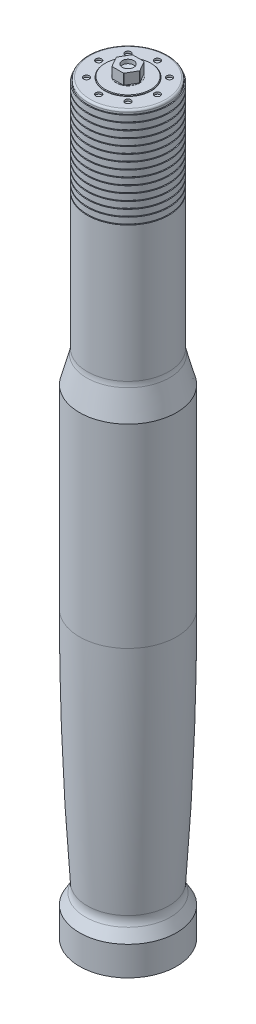
from build123d import *

# Parameters (mm, degrees)
SKETCH7_R          = 1
CUT_EXTRUDE1_DEPTH = 5.4
CIRPATTERN2_COUNT  = 8


with BuildPart() as part:
    # Sketch1 → Revolve1 (revolve)
    with BuildSketch(Plane.XY, mode=Mode.PRIVATE) as revolve1_sk:
        with BuildLine():
            Line((-19, 190.92476708), (-19, -190.92476708))
            Line((-19, -190.92476708), (-25, -190.92476708))
            Line((-25, -190.92476708), (-25, -175.92476708))
            Line((-25, -175.92476708), (-21.881748411, -170.523796897))
            ThreePointArc((-21.881748411, -170.523796897), (-21.053040899, -168.29863928), (-21, -165.92476708))
            ThreePointArc((-21, -165.92476708), (-23.999731053, -104.996900832), (-25, -44.00343615))
            Line((-25, -44.00343615), (-25, 55.99656385))
            Line((-25, 55.99656385), (-21.340741737, 69.653101605))
            ThreePointArc((-21.340741737, 69.653101605), (-21.085551386, 70.936030134), (-21, 72.241292056))
            Line((-21, 72.241292056), (-21, 141.92476708))
            Line((-21, 141.92476708), (-20.5, 141.92476708))
            Line((-20.5, 141.92476708), (-20.5, 142.42476708))
            Line((-20.5, 142.42476708), (-21, 142.42476708))
            Line((-21, 142.42476708), (-21, 145.42476708))
            Line((-21, 145.42476708), (-20.5, 145.42476708))
            Line((-20.5, 145.42476708), (-20.5, 145.92476708))
            Line((-20.5, 145.92476708), (-21, 145.92476708))
            Line((-21, 145.92476708), (-21, 148.92476708))
            Line((-21, 148.92476708), (-20.5, 148.92476708))
            Line((-20.5, 148.92476708), (-20.5, 149.42476708))
            Line((-20.5, 149.42476708), (-21, 149.42476708))
            Line((-21, 149.42476708), (-21, 152.42476708))
            Line((-21, 152.42476708), (-20.5, 152.42476708))
            Line((-20.5, 152.42476708), (-20.5, 152.92476708))
            Line((-20.5, 152.92476708), (-21, 152.92476708))
            Line((-21, 152.92476708), (-21, 155.92476708))
            Line((-21, 155.92476708), (-20.5, 155.92476708))
            Line((-20.5, 155.92476708), (-20.5, 156.42476708))
            Line((-20.5, 156.42476708), (-21, 156.42476708))
            Line((-21, 156.42476708), (-21, 159.42476708))
            Line((-21, 159.42476708), (-20.5, 159.42476708))
            Line((-20.5, 159.42476708), (-20.5, 159.92476708))
            Line((-20.5, 159.92476708), (-21, 159.92476708))
            Line((-21, 159.92476708), (-21, 162.92476708))
            Line((-21, 162.92476708), (-20.5, 162.92476708))
            Line((-20.5, 162.92476708), (-20.5, 163.42476708))
            Line((-20.5, 163.42476708), (-21, 163.42476708))
            Line((-21, 163.42476708), (-21, 166.42476708))
            Line((-21, 166.42476708), (-20.5, 166.42476708))
            Line((-20.5, 166.42476708), (-20.5, 166.92476708))
            Line((-20.5, 166.92476708), (-21, 166.92476708))
            Line((-21, 166.92476708), (-21, 169.92476708))
            Line((-21, 169.92476708), (-20.5, 169.92476708))
            Line((-20.5, 169.92476708), (-20.5, 170.42476708))
            Line((-20.5, 170.42476708), (-21, 170.42476708))
            Line((-21, 170.42476708), (-21, 173.42476708))
            Line((-21, 173.42476708), (-20.5, 173.42476708))
            Line((-20.5, 173.42476708), (-20.5, 173.92476708))
            Line((-20.5, 173.92476708), (-21, 173.92476708))
            Line((-21, 173.92476708), (-21, 176.92476708))
            Line((-21, 176.92476708), (-20.5, 176.92476708))
            Line((-20.5, 176.92476708), (-20.5, 177.42476708))
            Line((-20.5, 177.42476708), (-21, 177.42476708))
            Line((-21, 177.42476708), (-21, 180.42476708))
            Line((-21, 180.42476708), (-20.5, 180.42476708))
            Line((-20.5, 180.42476708), (-20.5, 180.92476708))
            Line((-20.5, 180.92476708), (-21, 180.92476708))
            Line((-21, 180.92476708), (-21, 183.92476708))
            Line((-21, 183.92476708), (-20.5, 183.92476708))
            Line((-20.5, 183.92476708), (-20.5, 184.42476708))
            Line((-20.5, 184.42476708), (-21, 184.42476708))
            Line((-21, 184.42476708), (-21, 187.42476708))
            Line((-21, 187.42476708), (-20.5, 187.42476708))
            Line((-20.5, 187.42476708), (-20.5, 187.92476708))
            Line((-20.5, 187.92476708), (-21, 187.92476708))
            Line((-21, 187.92476708), (-21, 190.92476708))
            Line((-21, 190.92476708), (-19, 190.92476708))
        make_face()
    revolve(revolve1_sk.sketch.rotate(Axis((0, 0, 0), (0, 1, 0)), 270), axis=Axis((0, 0, 0), (0, 1, 0)))


with BuildPart() as body_2:
    # Sketch4 → Revolve2 (revolve)
    with BuildSketch(Plane(origin=(0, 0, 0), x_dir=(0, 0, -1), z_dir=(1, 0, 0))):
        with BuildLine():
            Line((-20.5, 190.92476708), (0, 190.92476708))
            Line((0, 190.92476708), (0, 192.92476708))
            Line((0, 192.92476708), (-19.5, 192.92476708))
            ThreePointArc((-19.5, 192.92476708), (-20.207106781, 192.631873861), (-20.5, 191.92476708))
            Line((-20.5, 191.92476708), (-20.5, 190.92476708))
        make_face()
    revolve(axis=Axis((0, 192.92476708, 0), (0, -1, 0)))

    # Sketch10 → Cut-Revolve2 (revolve, cut)
    with BuildSketch(Plane(origin=(0, 0, 0), x_dir=(0, 0, -1), z_dir=(1, 0, 0))):
        Polygon((-15.1, 192.92476708), (-15.1, 191.058741676), (-16.6, 191.92476708), (-16.6, 192.92476708), align=None)
    cut_revolve2 = revolve(axis=Axis((0, 192.92476708, 15.1), (0, -1, 0)), mode=Mode.SUBTRACT)

    # CirPattern2: Cut-Revolve2 ×8 about axis
    cirpattern2_axis = Axis((0, 0, 0), (0, 1, 0))
    for i in range(1, CIRPATTERN2_COUNT):
        add(cut_revolve2.rotate(cirpattern2_axis, i * 360 / CIRPATTERN2_COUNT), mode=Mode.SUBTRACT)


with BuildPart() as body_3:
    # Sketch6 → Revolve4 (revolve)
    with BuildSketch(Plane(origin=(0, 0, 0), x_dir=(0, 0, -1), z_dir=(1, 0, 0)), mode=Mode.PRIVATE) as revolve4_sk:
        Polygon((0, 192.92476708), (0, 198.92476708), (-6, 198.92476708), (-6, 193.42476708), (-11.7, 193.42476708), (-12, 193.12476708), (-12, 192.92476708), align=None)
    revolve(revolve4_sk.sketch.rotate(Axis((0, 192.92476708, 0), (0, 1, 0)), 180), axis=Axis((0, 192.92476708, 0), (0, 1, 0)))

    # Sketch7 → Cut-Extrude1 (cut)
    with BuildSketch(Plane(origin=(0, 198.92476708, 0), x_dir=(1, 0, 0), z_dir=(0, 1, 0))):
        with Locations(Location((0, 0, 0), (0, 0, 270))):
            Circle(SKETCH7_R)
        with BuildLine():
            Line((5.999002125, 0.109423525), (3.094264615, 5.140576475))
            ThreePointArc((3.094264615, 5.140576475), (5.196152423, 3), (5.999002125, 0.109423525))
        make_face()
        with BuildLine():
            Line((2.90473751, 5.25), (-2.90473751, 5.25))
            ThreePointArc((-2.90473751, 5.25), (0, 6), (2.90473751, 5.25))
        make_face()
        with BuildLine():
            Line((-3.094264615, 5.140576475), (-5.999002125, 0.109423525))
            ThreePointArc((-5.999002125, 0.109423525), (-5.196152423, 3), (-3.094264615, 5.140576475))
        make_face()
        with BuildLine():
            Line((-5.999002125, -0.109423525), (-3.094264615, -5.140576475))
            ThreePointArc((-3.094264615, -5.140576475), (-5.196152423, -3), (-5.999002125, -0.109423525))
        make_face()
        with BuildLine():
            Line((-2.90473751, -5.25), (2.90473751, -5.25))
            ThreePointArc((2.90473751, -5.25), (0, -6), (-2.90473751, -5.25))
        make_face()
        with BuildLine():
            Line((3.094264615, -5.140576475), (5.999002125, -0.109423525))
            ThreePointArc((5.999002125, -0.109423525), (5.196152423, -3), (3.094264615, -5.140576475))
        make_face()
    extrude(amount=-CUT_EXTRUDE1_DEPTH, mode=Mode.SUBTRACT)

    # Sketch9 → Cut-Revolve1 (revolve, cut)
    with BuildSketch(Plane(origin=(0, 0, 0), x_dir=(0, 0, -1), z_dir=(1, 0, 0))):
        Polygon((0, 198.92476708), (0, 195.92476708), (-3, 196.92476708), (-3, 198.92476708), align=None)
    revolve(axis=Axis((0, 198.92476708, 0), (0, -1, 0)), mode=Mode.SUBTRACT)


solid = Compound([part.part, body_2.part, body_3.part])
